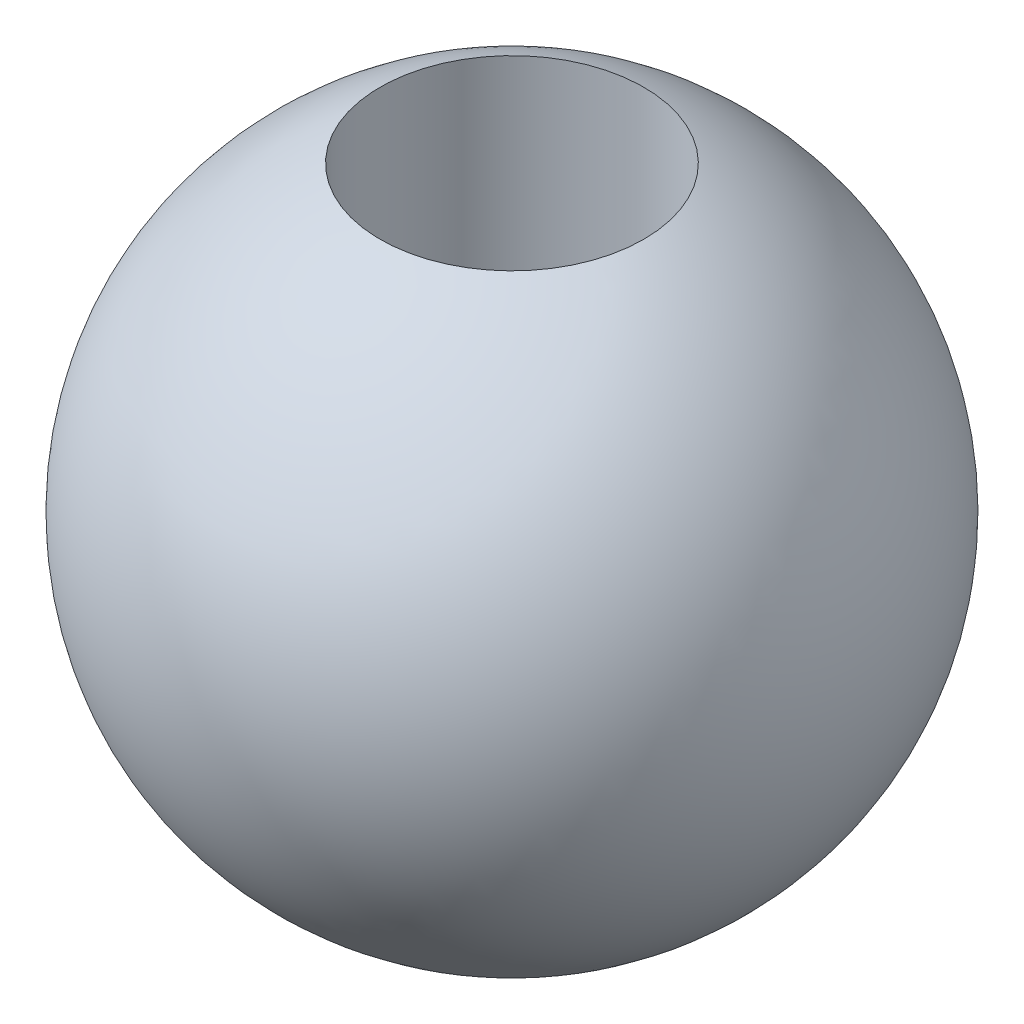
from build123d import *

# Parameters (mm, degrees)
ESQUISSE2_R             = 1
ENL_V_MAT_EXTRU_1_DEPTH = 5


with BuildPart() as part:
    # Esquisse1 → Révolution1 (revolve)
    with BuildSketch(Plane.XY):
        with BuildLine():
            Line((0, -2.5), (0, 2.5))
            ThreePointArc((0, 2.5), (-2.5, 0), (0, -2.5))
        make_face()
    revolve(axis=Axis((0, -2.5, 0), (0, 1, 0)))

    # Esquisse2 → Enlèv. mat.-Extru.1 (cut, symmetric)
    with BuildSketch(Plane(origin=(0, 0, 0), x_dir=(1, 0, 0), z_dir=(0, 1, 0))):
        Circle(ESQUISSE2_R)
    extrude(amount=ENL_V_MAT_EXTRU_1_DEPTH, both=True, mode=Mode.SUBTRACT)


solid = part.part
